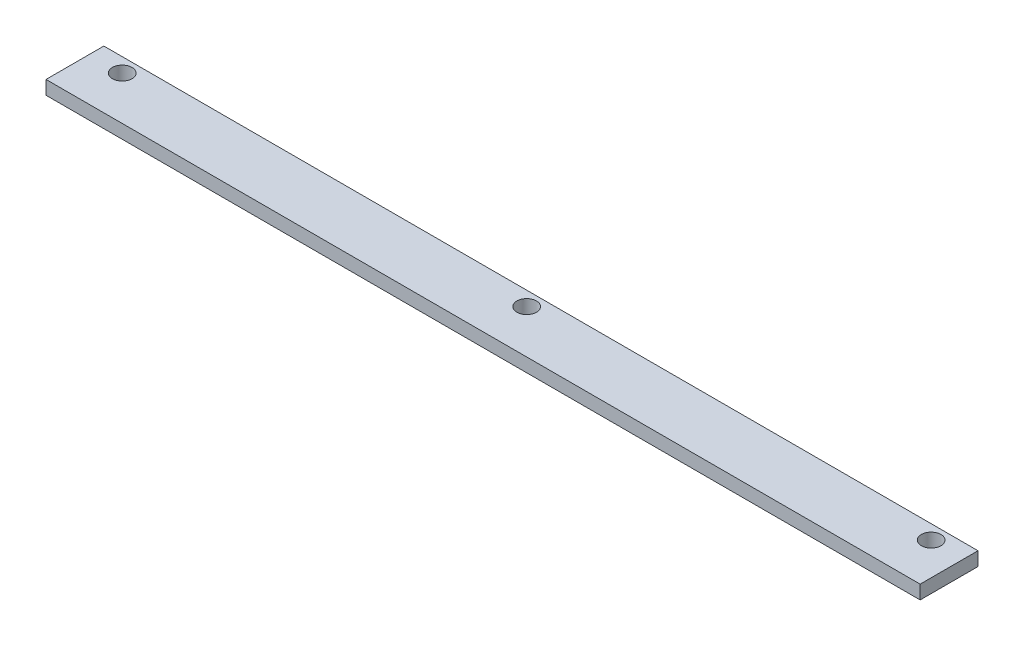
from build123d import *

# Parameters (mm, degrees)
SKETCH1_W           = 2.8
SKETCH1_H           = 178.3
BOSS_EXTRUDE1_DEPTH = 11.8
CUT_EXTRUDE1_REACH  = 180.812
SKETCH2_R           = 2
LPATTERN1_COUNT     = 3
LPATTERN1_PITCH     = 82.5


with BuildPart() as part:
    # Sketch1 → Boss-Extrude1 (new body)
    with BuildSketch(Plane(origin=(0, 0, 0), x_dir=(0, 1, 0), z_dir=(0, 0, 1))):
        with Locations((1.5, 89.25)):
            Rectangle(SKETCH1_W, SKETCH1_H)
    extrude(amount=BOSS_EXTRUDE1_DEPTH)

    # Sketch2 → Cut-Extrude1 (cut, up to next)
    with BuildSketch(Plane(origin=(0, 2.9, 0), x_dir=(-1, 0, 0), z_dir=(0, 1, 0)), mode=Mode.PRIVATE) as cut_extrude1_sk1:
        with Locations(Location((171.75, 2.9, 0), (0, 0, 90))):
            Circle(SKETCH2_R)
    cut_extrude1_tool1 = extrude(cut_extrude1_sk1.sketch, amount=-CUT_EXTRUDE1_REACH, mode=Mode.PRIVATE) & part.part
    cut_extrude1 = cut_extrude1_tool1.solids().sort_by_distance((-171.75, 2.9, 2.9))[0]
    add(cut_extrude1, mode=Mode.SUBTRACT)

    # LPattern1: Cut-Extrude1 ×3
    with Locations(*[(i * LPATTERN1_PITCH, 0, 0) for i in range(1, LPATTERN1_COUNT)]):
        add(cut_extrude1, mode=Mode.SUBTRACT)


solid = part.part
